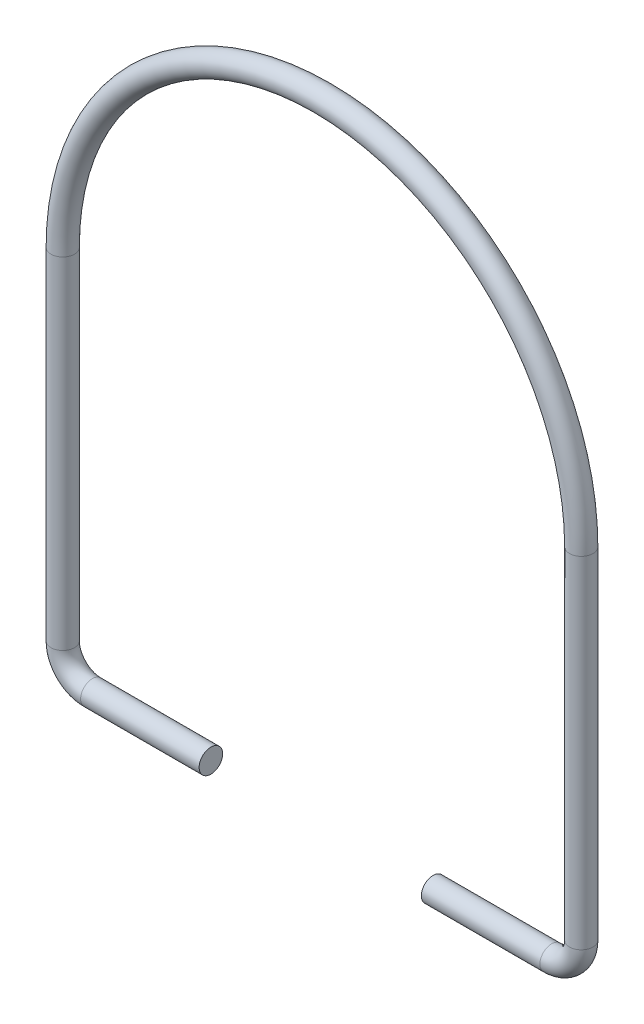
from build123d import *

# Parameters (mm, degrees)
SKETCH2_R = 1.5875


with BuildPart() as part:
    # Sweep1: sweep along a path in Sketch1
    with BuildLine(Plane.XY) as sweep1_path:
        Line((0, 0), (-16, 0))
        ThreePointArc((-16, 0), (-18.828427125, 1.171572875), (-20, 4))
        Line((-20, 4), (-20, 50))
        ThreePointArc((-20, 50), (15, 85), (50, 50))
        Line((50, 50), (50, 4))
        ThreePointArc((50, 4), (48.828427125, 1.171572875), (46, 0))
        Line((46, 0), (30, 0))
    # Sketch2 → Sweep1 (sweep)
    with BuildSketch(Plane(origin=(0, 0, 0), x_dir=(0, 0, -1), z_dir=(1, 0, 0))):
        Circle(SKETCH2_R)
    sweep(path=sweep1_path.line)


solid = part.part
